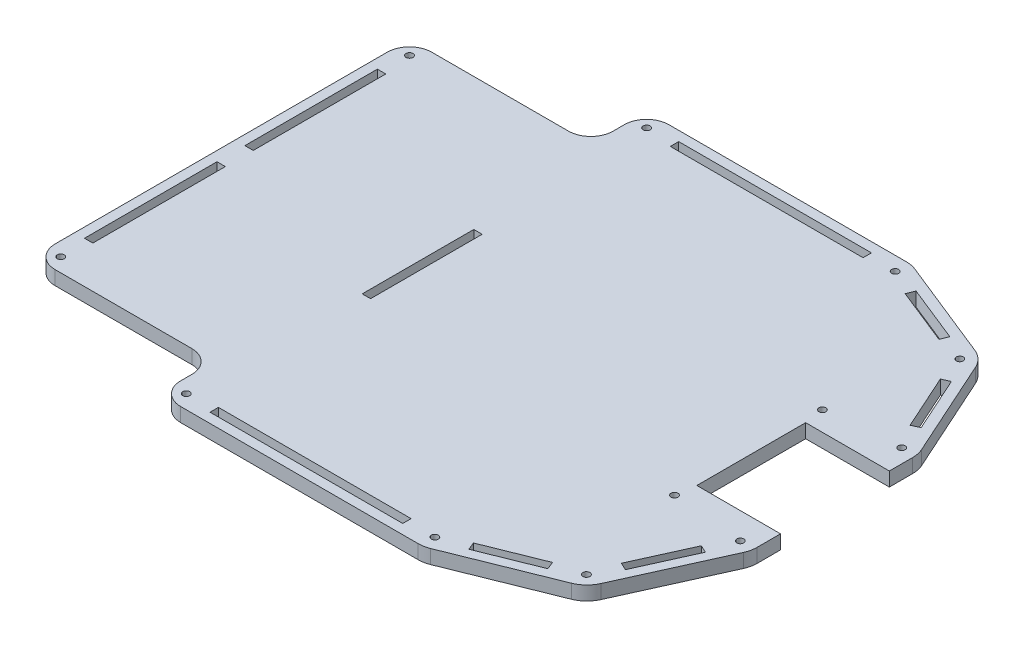
from build123d import *

# Parameters (mm, degrees)
ESTRUSIONE_ESTRUSIONE1_DEPTH  = 5
FORO_FILETTATO_M3X0_5_1_D     = 2.5
FORO_FILETTATO_M3X0_5_1_DEPTH = 7.5
FORO_FILETTATO_M3X0_5_1_TIP   = 0.751075774
SCHIZZO4_W                    = 69.084596206
SCHIZZO4_H                    = 3
TAGLIO_ESTRUSIONE2_DEPTH      = 10
SCHIZZO7_W                    = 3
SCHIZZO7_H                    = 47.5
TAGLIO_ESTRUSIONE5_DEPTH      = 10
SCHIZZO12_W                   = 3
SCHIZZO12_H                   = 40
TAGLIO_ESTRUSIONE8_DEPTH      = 237.814801058
TAGLIO_ESTRUSIONE1_DEPTH      = 237.814801058
TAGLIO_ESTRUSIONE1_DEPTH_BACK = 237.814801058
FORO_FILETTATO_M3X0_5_4_D     = 2.5
RACCORDO1_R                   = 8
RACCORDO2_R                   = 10


with BuildPart() as part:
    # Schizzo1 → Estrusione-Estrusione1 (new body)
    with BuildSketch(Plane(origin=(0, 0, 0), x_dir=(1, 0, 0), z_dir=(0, 1, 0))):
        Polygon((65, 67.5), (65, 87.5), (160.052105959, 87.5), (201.585225273, 70.801270189), (220, 30), (220, -30), (201.585225273, -70.801270189), (160.052105959, -87.5), (65, -87.5), (65, -67.5), (0, -67.5), (0, 67.5), align=None)
    extrude(amount=ESTRUSIONE_ESTRUSIONE1_DEPTH)

    # Foro filettato M3x0.5-1
    with Locations(Plane(origin=(0, 5, 0), x_dir=(1, 0, 0), z_dir=(0, 1, 0))):
        with Locations((197.854862265, 66.912097904), (215, 28.92393853), (215, -28.92393853), (197.854862265, -66.912097904), (159.084596206, -82.5), (159.084596206, 82.5), (70, 82.5), (70, -82.5), (5, -62.5), (5, 62.5)):
            Hole(FORO_FILETTATO_M3X0_5_1_D / 2, depth=FORO_FILETTATO_M3X0_5_1_DEPTH)
            with Locations((0, 0, -(FORO_FILETTATO_M3X0_5_1_DEPTH + FORO_FILETTATO_M3X0_5_1_TIP / 2))):  # 118° drill point
                Cone(0, FORO_FILETTATO_M3X0_5_1_D / 2, FORO_FILETTATO_M3X0_5_1_TIP, mode=Mode.SUBTRACT)

    # Schizzo4 → Taglio-Estrusione2 (cut)
    with BuildSketch(Plane(origin=(0, 5, 0), x_dir=(1, 0, 0), z_dir=(0, 1, 0))):
        with Locations((114.542298103, -82.5)):
            Rectangle(SCHIZZO4_W, SCHIZZO4_H)
        Polygon((209.519084515, 37.421559693), (200.601374282, 57.180362615), (203.33577775, 58.414476741), (212.253487983, 38.655673819), align=None)
        with Locations((114.542298103, 82.5)):
            Rectangle(SCHIZZO4_W, SCHIZZO4_H)
        Polygon((189.136249234, 72.034186035), (168.92231814, 80.161362114), (167.803209237, 77.377911869), (188.017140331, 69.250735791), align=None)
        Polygon((167.803209237, -77.377911869), (188.017140331, -69.250735791), (189.136249234, -72.034186035), (168.92231814, -80.161362114), align=None)
        Polygon((200.601374282, -57.180362615), (209.519084515, -37.421559693), (212.253487983, -38.655673819), (203.33577775, -58.414476741), align=None)
    extrude(amount=-TAGLIO_ESTRUSIONE2_DEPTH, mode=Mode.SUBTRACT)

    # Schizzo7 → Taglio-Estrusione5 (cut)
    with BuildSketch(Plane(origin=(0, 5, 0), x_dir=(1, 0, 0), z_dir=(0, 1, 0))):
        with Locations((5, 28.75)):
            Rectangle(SCHIZZO7_W, SCHIZZO7_H)
        with Locations((5, -28.75)):
            Rectangle(SCHIZZO7_W, SCHIZZO7_H)
    extrude(amount=-TAGLIO_ESTRUSIONE5_DEPTH, mode=Mode.SUBTRACT)

    # Schizzo12 → Taglio-Estrusione8 (cut, through all)
    with BuildSketch(Plane(origin=(0, 5, 0), x_dir=(1, 0, 0), z_dir=(0, 1, 0))):
        with Locations((72.042298103, 0)):
            Rectangle(SCHIZZO12_W, SCHIZZO12_H)
    extrude(amount=-TAGLIO_ESTRUSIONE8_DEPTH, mode=Mode.SUBTRACT)

    # Schizzo2 → Taglio-Estrusione1 (cut, two sides: drawn at the far end of the back side and taken through both)
    with BuildSketch(Plane(origin=(0, 5, 0), x_dir=(1, 0, 0), z_dir=(0, 1, 0)).offset(-TAGLIO_ESTRUSIONE1_DEPTH_BACK)):
        Polygon((719.281105296, 19.5), (220, 19.5), (190, 19.5), (190, -19.5), (220, -19.5), (719.281105296, -19.5), (1717.843315889, -19.5), (1717.843315889, 19.5), align=None)
    extrude(amount=TAGLIO_ESTRUSIONE1_DEPTH + TAGLIO_ESTRUSIONE1_DEPTH_BACK, mode=Mode.SUBTRACT)

    # Foro filettato M3x0.5-4 (through all)
    with Locations(Plane(origin=(0, 5, 0), x_dir=(1, 0, 0), z_dir=(0, 1, 0))):
        with Locations((189, 26.5), (189, -26.5)):
            Hole(FORO_FILETTATO_M3X0_5_4_D / 2)

    # Raccordo1
    raccordo1_edges = [part.edges().sort_by_distance(p)[0] for p in [
        (0, 2.5, -67.5),
        (65, 2.5, -67.5),
        (65, 2.5, -87.5),
        (65, 2.5, 87.5),
        (65, 2.5, 67.5),
        (0, 2.5, 67.5),
    ]]
    fillet(raccordo1_edges, radius=RACCORDO1_R)

    # Raccordo2
    raccordo2_edges = [part.edges().sort_by_distance(p)[0] for p in [
        (160.052105959, 2.5, -87.5),
        (201.585225273, 2.5, -70.801270189),
        (220, 2.5, -30),
        (220, 2.5, 30),
        (201.585225273, 2.5, 70.801270189),
        (160.052105959, 2.5, 87.5),
    ]]
    fillet(raccordo2_edges, radius=RACCORDO2_R)


solid = part.part
